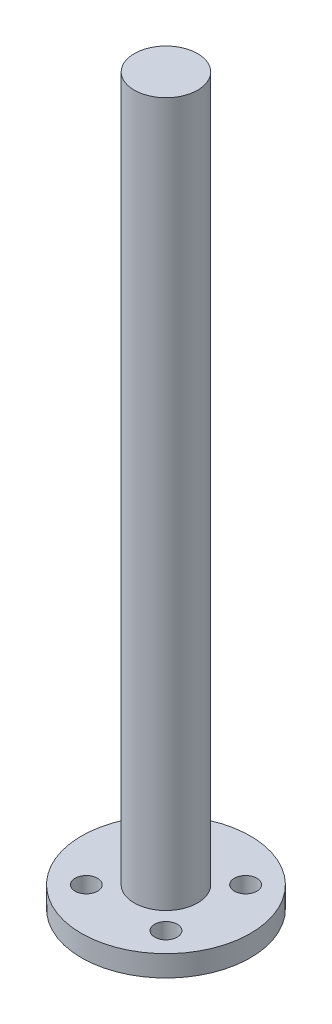
from build123d import *

# Parameters (mm, degrees)
SKETCH_1_R          = 12
EXTRUDE_2_DEPTH     = 3
SKETCH_2_R          = 1.6
CUT_EXTRUDE_1_DEPTH = 3
SKETCH_3_R          = 4.5
EXTRUDE_3_DEPTH     = 100


with BuildPart() as part:
    # 草图1 → 凸台-拉伸2 (new body)
    with BuildSketch(Plane(origin=(0, 0, 0), x_dir=(1, 0, 0), z_dir=(0, 1, 0))):
        with Locations(Location((0, 0, 0), (0, 0, 270))):
            Circle(SKETCH_1_R)
    extrude(amount=-EXTRUDE_2_DEPTH)

    # 草图2 → 切除-拉伸1 (cut)
    with BuildSketch(Plane(origin=(0, 0, 0), x_dir=(1, 0, 0), z_dir=(0, 1, 0))):
        with Locations(Location((5.656854249, -5.656854249, 0), (0, 0, 270))):
            Circle(SKETCH_2_R)
        with Locations(Location((-5.656854249, -5.656854249, 0), (0, 0, 270))):
            Circle(SKETCH_2_R)
        with Locations(Location((-5.656854249, 5.656854249, 0), (0, 0, 270))):
            Circle(SKETCH_2_R)
        with Locations(Location((5.656854249, 5.656854249, 0), (0, 0, 270))):
            Circle(SKETCH_2_R)
    extrude(amount=-CUT_EXTRUDE_1_DEPTH, mode=Mode.SUBTRACT)

    # 草图3 → 凸台-拉伸3 (add)
    with BuildSketch(Plane(origin=(0, 0, 0), x_dir=(1, 0, 0), z_dir=(0, 1, 0))):
        with Locations(Location((0, 0, 0), (0, 0, 270))):
            Circle(SKETCH_3_R)
    extrude(amount=EXTRUDE_3_DEPTH)


solid = part.part
